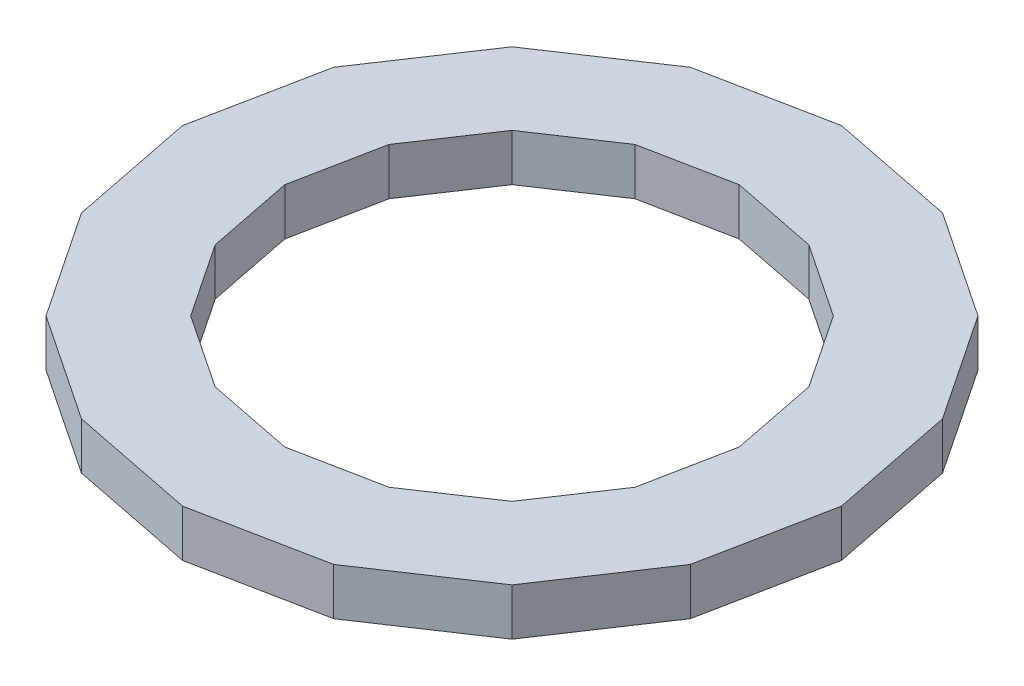
from build123d import *

# Parameters (mm, degrees)
BOSS_EXTRUDE1_DEPTH = 19.05


with BuildPart() as part:
    # Sketch1 → Boss-Extrude1 (new body)
    with BuildSketch(Plane(origin=(0, 0, 0), x_dir=(1, 0, 0), z_dir=(0, 1, 0))):
        Polygon((133.451007364, 0), (123.292654297, 51.069489551), (94.364112263, 94.364112263), (51.069489551, 123.292654297), (0, 133.451007364), (-51.069489551, 123.292654297), (-94.364112263, 94.364112263), (-123.292654297, 51.069489551), (-133.451007364, 0), (-123.292654297, -51.069489551), (-94.364112263, -94.364112263), (-51.069489551, -123.292654297), (0, -133.451007364), (51.069489551, -123.292654297), (94.364112263, -94.364112263), (123.292654297, -51.069489551), align=None)
        Polygon((92.014822694, 0), (85.010611375, 35.212548177), (65.064305097, 65.064305097), (35.212548177, 85.010611375), (0, 92.014822694), (-35.212548177, 85.010611375), (-65.064305097, 65.064305097), (-85.010611375, 35.212548177), (-92.014822694, 0), (-85.010611375, -35.212548177), (-65.064305097, -65.064305097), (-35.212548177, -85.010611375), (0, -92.014822694), (35.212548177, -85.010611375), (65.064305097, -65.064305097), (85.010611375, -35.212548177), align=None, mode=Mode.SUBTRACT)
    extrude(amount=BOSS_EXTRUDE1_DEPTH)


solid = part.part
